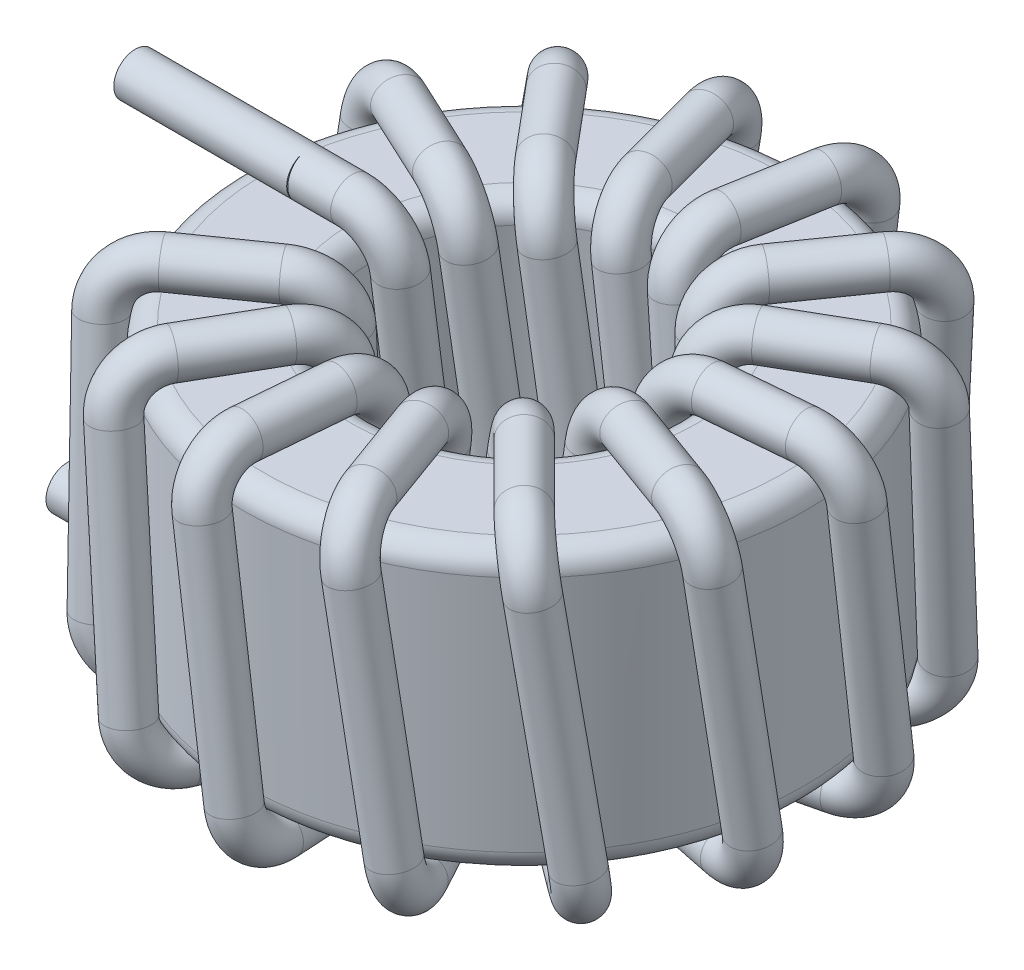
from build123d import *

# Parameters (mm, degrees)
BARRER3_PROFILE_R        = 0.495
MATRIZC1_COUNT           = 14
MATRIZC1_ANGLE           = 325
CORTAR_REVOLUCI_N1_ANGLE = 24
CROQUIS173_R             = 0.495
SALIENTE_EXTRUIR1_DEPTH  = 4


with BuildPart() as part:
    # Croquis1 → Revolución1 (revolve)
    with BuildSketch(Plane.XY, mode=Mode.PRIVATE) as revoluci_n1_sk:
        with BuildLine():
            Line((-6, 3.25), (-4, 3.25))
            ThreePointArc((-4, 3.25), (-3.646446609, 3.103553391), (-3.5, 2.75))
            Line((-3.5, 2.75), (-3.5, -2.75))
            ThreePointArc((-3.5, -2.75), (-3.646446609, -3.103553391), (-4, -3.25))
            Line((-4, -3.25), (-6, -3.25))
            ThreePointArc((-6, -3.25), (-6.353553391, -3.103553391), (-6.5, -2.75))
            Line((-6.5, -2.75), (-6.5, 2.75))
            ThreePointArc((-6.5, 2.75), (-6.353553391, 3.103553391), (-6, 3.25))
        make_face()
    revolve(revoluci_n1_sk.sketch.rotate(Axis((0, 0, 0), (0, 1, 0)), 270), axis=Axis((0, 0, 0), (0, 1, 0)))

    # Barrer3: sweep along a curve in space
    with BuildLine() as barrer3_path:
        Line((-5, 3.75, 0), (-3.983473154, 3.75, 0))
        ThreePointArc((-3.983473154, 3.75, 0), (-3.282282522, 3.464841004, -0.032685828), (-2.983611998, 2.7730602, -0.111979937))
        Line((-2.983611998, 2.7730602, -0.111979937), (-2.890576756, -2.7730602, -0.747693843))
        ThreePointArc((-2.890576756, -2.7730602, -0.747693843), (-3.153999554, -3.464841004, -0.909248994), (-3.816417913, -3.75, -1.141495808))
        Line((-3.816417913, -3.75, -1.141495808), (-5.738942895, -3.75, -1.716525655))
        ThreePointArc((-5.738942895, -3.75, -1.716525655), (-6.408303015, -3.456317766, -1.958269912), (-6.658104049, -2.749346071, -2.132978175))
        Line((-6.658104049, -2.749346071, -2.132978175), (-6.392490886, 2.749346071, -2.831255144))
        ThreePointArc((-6.392490886, 2.749346071, -2.831255144), (-6.089728826, 3.456317766, -2.795777424), (-5.428921773, 3.75, -2.531547798))
        Line((-5.428921773, 3.75, -2.531547798), (-4.531538935, 3.75, -2.113091309))
    # Barrer3 profile (on start of the path) → Barrer3 (sweep)
    with BuildSketch(Plane(origin=(-5, 3.75, 0), x_dir=(0, 0, 1), z_dir=(1, 0, 0))):
        Circle(BARRER3_PROFILE_R)
    barrer3 = sweep(path=barrer3_path.line)

    # MatrizC1: Barrer3 ×14 about axis
    matrizc1_axis = Axis((0, 0, 0), (0, -1, 0))
    for i in range(1, MATRIZC1_COUNT):
        add(barrer3.rotate(matrizc1_axis, i * MATRIZC1_ANGLE / (MATRIZC1_COUNT - 1)))

    # Croquis172 → Cortar-Revolución1 (revolve, cut)
    with BuildSketch(Plane.XY):
        with BuildLine():
            Line((-5, 3.25), (-5, 5.223036903))
            Line((-5, 5.223036903), (-8.745633583, 5.223036903))
            Line((-8.745633583, 5.223036903), (-8.745633583, -4.977068323))
            Line((-8.745633583, -4.977068323), (-5, -4.977068323))
            Line((-5, -4.977068323), (-5, -3.25))
            Line((-5, -3.25), (-6, -3.25))
            ThreePointArc((-6, -3.25), (-6.353553391, -3.103553391), (-6.5, -2.75))
            Line((-6.5, -2.75), (-6.5, 2.75))
            ThreePointArc((-6.5, 2.75), (-6.353553391, 3.103553391), (-6, 3.25))
            Line((-6, 3.25), (-5, 3.25))
        make_face()
    revolve(axis=Axis((0, 0, 0), (0, 1, 0)), revolution_arc=CORTAR_REVOLUCI_N1_ANGLE, mode=Mode.SUBTRACT)

    # Croquis173 → Saliente-Extruir1 (add)
    with BuildSketch(Plane.ZY.offset(5)):
        with Locations(Location((1.56750032, -3.741585404, 0), (0, 0, 96.733729923))):
            Circle(CROQUIS173_R)
        with Locations(Location((0, 3.75, 0), (0, 0, 83.46111343))):
            Circle(CROQUIS173_R)
    extrude(amount=SALIENTE_EXTRUIR1_DEPTH)


solid = part.part
